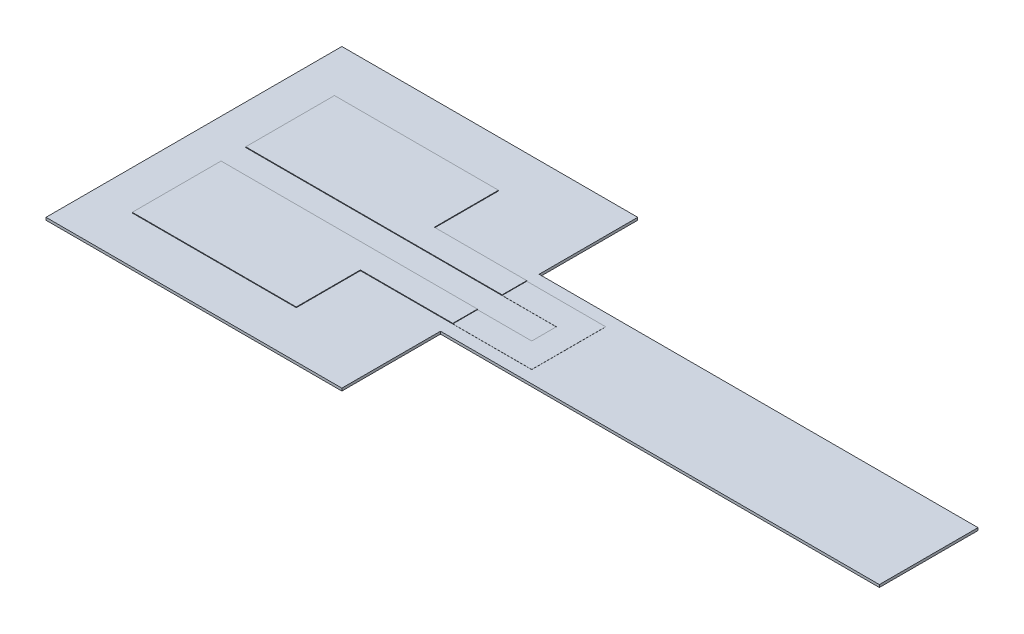
from build123d import *

# Parameters (mm, degrees)
BOSS_EXTRUDE1_DEPTH      = 0.0001
BOSS_EXTRUDE1_DEPTH_BACK = 0.26
BOSS_EXTRUDE2_DEPTH      = 0.0126
BOSS_EXTRUDE3_DEPTH      = 0.0666


with BuildPart() as part:
    # Sketch1 → Boss-Extrude1 (new, two sides: drawn at the far end of the back side and taken through both)
    with BuildSketch(Plane(origin=(0, 0, 0), x_dir=(1, 0, 0), z_dir=(0, 1, 0)).offset(-BOSS_EXTRUDE1_DEPTH_BACK)):
        Polygon((0, -15), (30, -15), (30, -5), (74.5, -5), (74.5, 5), (30, 5), (30, 15), (0, 15), align=None)
    extrude(amount=BOSS_EXTRUDE1_DEPTH + BOSS_EXTRUDE1_DEPTH_BACK)

    # Sketch3 → Boss-Extrude2 (add)
    with BuildSketch(Plane(origin=(0, 0.0001, 0), x_dir=(1, 0, 0), z_dir=(0, 1, 0))):
        Polygon((30, 3.75), (30, 1.25), (35.5, 1.25), (35.5, -1.25), (30, -1.25), (30, -3.75), (38, -3.75), (38, 3.75), align=None)
    extrude(amount=BOSS_EXTRUDE2_DEPTH)

    # Sketch4 → Boss-Extrude3 (add)
    with BuildSketch(Plane(origin=(0, 0.0001, 0), x_dir=(1, 0, 0), z_dir=(0, 1, 0))):
        Polygon((4, 10.25), (4, 1.25), (30, 1.25), (30, 3.75), (20.627589053, 3.75), (20.627589053, 10.25), align=None)
        Polygon((30, -1.25), (4, -1.25), (4, -10.25), (20.627589053, -10.25), (20.627589053, -3.75), (30, -3.75), align=None)
    extrude(amount=BOSS_EXTRUDE3_DEPTH)


solid = part.part
